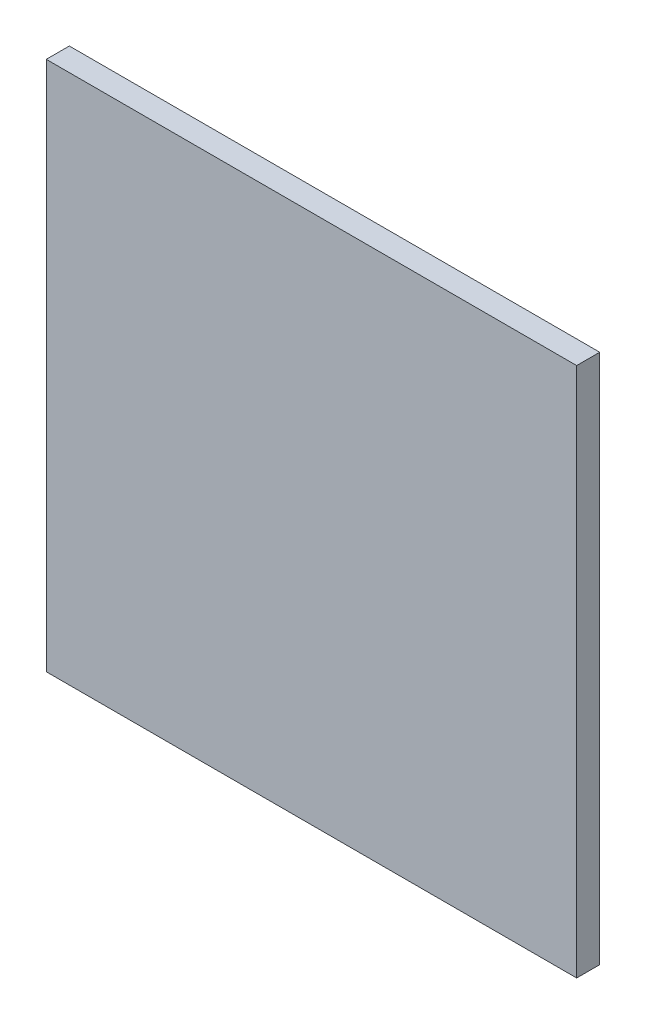
from build123d import *

# Parameters (mm, degrees)
SKETCH1_W           = 460
SKETCH1_H           = 460
BOSS_EXTRUDE1_DEPTH = 20


with BuildPart() as part:
    # Sketch1 → Boss-Extrude1 (new body)
    with BuildSketch(Plane.XY):
        with Locations((230, -230)):
            Rectangle(SKETCH1_W, SKETCH1_H)
    extrude(amount=BOSS_EXTRUDE1_DEPTH)


solid = part.part
